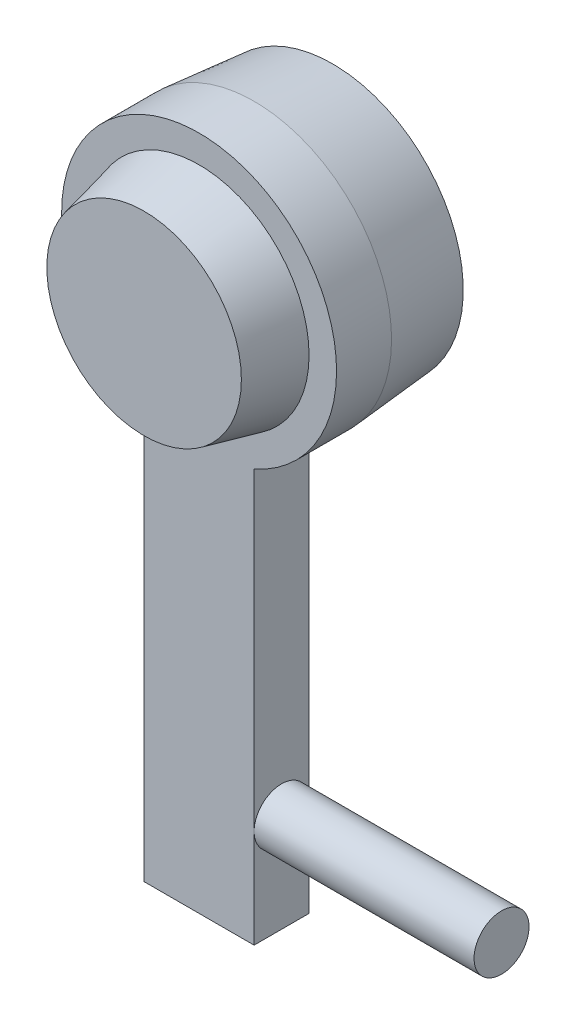
from build123d import *

# Parameters (mm, degrees)
BOSS_EXTRUDE1_DEPTH = 5
SKETCH2_R           = 20
BOSS_EXTRUDE2_DEPTH = 10
BOSS_EXTRUDE2_TAPER = 13
SKETCH3_R           = 25
SKETCH3_R_2         = 22.5
BOSS_EXTRUDE3_DEPTH = 15
BOSS_EXTRUDE3_TAPER = 5
SKETCH4_R           = 5
BOSS_EXTRUDE4_DEPTH = 40


with BuildPart() as part:
    # Sketch1 → Boss-Extrude1 (new, symmetric)
    with BuildSketch(Plane.XY):
        with BuildLine():
            Line((-10, -22.912878475), (-10, -97.912878475))
            Line((-10, -97.912878475), (10, -97.912878475))
            Line((10, -97.912878475), (10, -22.912878475))
            ThreePointArc((10, -22.912878475), (0, 25), (-10, -22.912878475))
        make_face()
    extrude(amount=BOSS_EXTRUDE1_DEPTH, both=True)

    # Sketch2 → Boss-Extrude2 (add)
    with BuildSketch(Plane.XY.offset(5)):
        Circle(SKETCH2_R)
    extrude(amount=BOSS_EXTRUDE2_DEPTH, taper=BOSS_EXTRUDE2_TAPER)

    # Sketch3 → Boss-Extrude3 (add)
    with BuildSketch(Plane(origin=(0, 0, -5), x_dir=(-1, 0, 0), z_dir=(0, 0, -1))):
        Circle(SKETCH3_R)
        Circle(SKETCH3_R_2, mode=Mode.SUBTRACT)
    extrude(amount=BOSS_EXTRUDE3_DEPTH, taper=BOSS_EXTRUDE3_TAPER)

    # Sketch4 → Boss-Extrude4 (add)
    with BuildSketch(Plane(origin=(10, 0, 0), x_dir=(0, 0, -1), z_dir=(1, 0, 0))):
        with Locations((0, -80)):
            Circle(SKETCH4_R)
    extrude(amount=BOSS_EXTRUDE4_DEPTH)


solid = part.part
